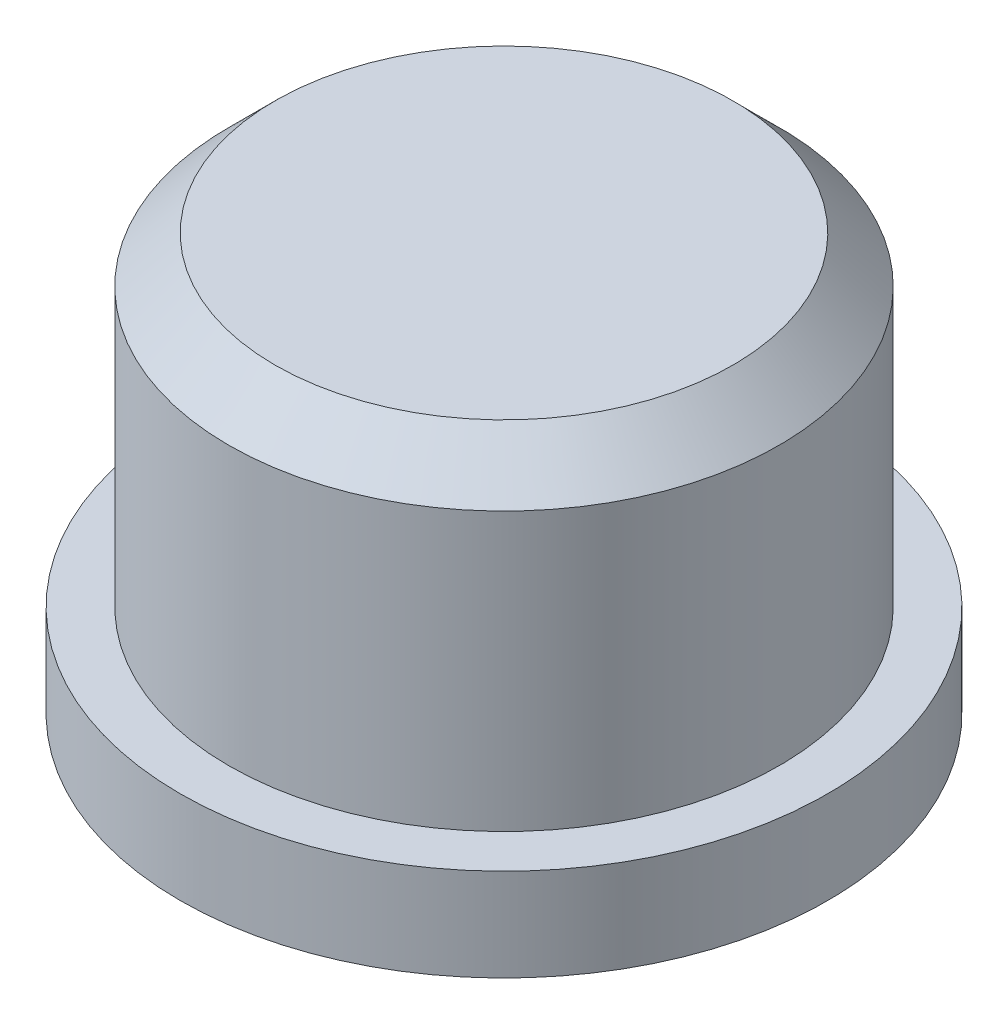
from build123d import *

# Parameters (mm, degrees)
SKETCH1_R           = 7
BOSS_EXTRUDE1_DEPTH = 2
SKETCH2_R           = 5.95
BOSS_EXTRUDE2_DEPTH = 7
SKETCH3_W           = 3.8
SKETCH3_H           = 3.8
CUT_EXTRUDE1_DEPTH  = 1.8
CHAMFER1_SIZE       = 1


with BuildPart() as part:
    # Sketch1 → Boss-Extrude1 (new body)
    with BuildSketch(Plane(origin=(0, 0, 0), x_dir=(1, 0, 0), z_dir=(0, 1, 0))):
        with Locations(Location((0, 0, 0), (0, 0, 270))):
            Circle(SKETCH1_R)
    extrude(amount=BOSS_EXTRUDE1_DEPTH)

    # Sketch2 → Boss-Extrude2 (add)
    with BuildSketch(Plane(origin=(0, 2, 0), x_dir=(1, 0, 0), z_dir=(0, 1, 0))):
        with Locations(Location((0, 0, 0), (0, 0, 270))):
            Circle(SKETCH2_R)
    extrude(amount=BOSS_EXTRUDE2_DEPTH)

    # Sketch3 → Cut-Extrude1 (cut)
    with BuildSketch(Plane.XZ):
        with BuildLine():
            ThreePointArc((-1.9, 1.9), (-2.687005769, 0), (-1.9, -1.9))
            Line((-1.9, -1.9), (-1.9, 1.9))
        make_face()
        Rectangle(SKETCH3_W, SKETCH3_H)
        with BuildLine():
            ThreePointArc((1.9, 1.9), (0, 2.687005769), (-1.9, 1.9))
            Line((-1.9, 1.9), (1.9, 1.9))
        make_face()
        with BuildLine():
            Line((1.9, 1.9), (1.9, -1.9))
            ThreePointArc((1.9, -1.9), (2.482469633, -1.02827259), (2.687005769, 0))
            ThreePointArc((2.687005769, 0), (2.482469633, 1.02827259), (1.9, 1.9))
        make_face()
        with BuildLine():
            Line((1.9, -1.9), (-1.9, -1.9))
            ThreePointArc((-1.9, -1.9), (0, -2.687005769), (1.9, -1.9))
        make_face()
    extrude(amount=-CUT_EXTRUDE1_DEPTH, mode=Mode.SUBTRACT)

    # Chamfer1
    chamfer1_edges = [part.edges().sort_by_distance(p)[0] for p in [
        (0, 9, -5.95),
    ]]
    chamfer(chamfer1_edges, length=CHAMFER1_SIZE)


solid = part.part
